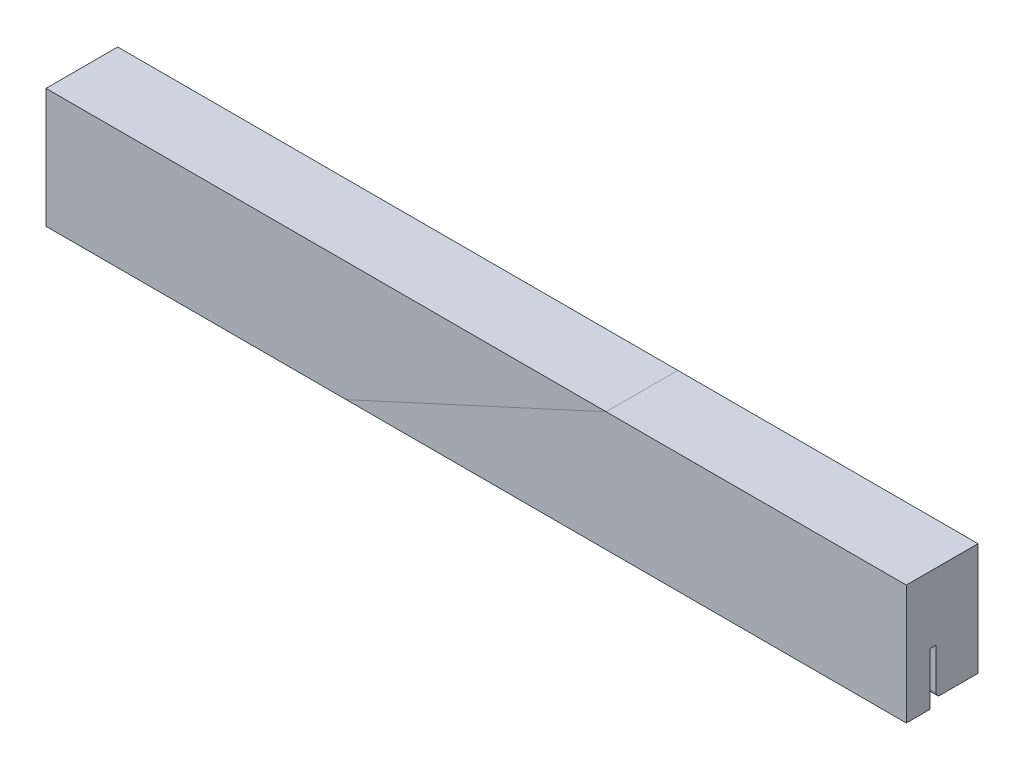
from build123d import *

# Parameters (mm, degrees)
SKETCH1_W              = 228.6
SKETCH1_H              = 25.4
SKETCH1_H_2            = 6.35
BOSS_EXTRUDE1_DEPTH    = 6.35
SKETCH1_3_W            = 228.6
SKETCH1_3_H            = 6.35
BOSS_EXTRUDE2_DEPTH    = 12.7
BOSS_EXTRUDE3_DEPTH    = 228.6
FILLET1_R              = 1.016
SPLIT2_SURFACE_1_BACK  = 232.579
SPLIT2_SURFACE_1_DEPTH = 465.158
SPLIT2_SURFACE_2_BACK  = 232.579
SPLIT2_SURFACE_2_DEPTH = 465.158


with BuildPart() as part:
    # Sketch1 → Boss-Extrude1 (new body)
    with BuildSketch(Plane.XY):
        Rectangle(SKETCH1_W, SKETCH1_H)
        with Locations((0, 15.875)):
            Rectangle(SKETCH1_W, SKETCH1_H_2)
    extrude(amount=BOSS_EXTRUDE1_DEPTH)

    # Sketch1<3> → Boss-Extrude2 (add)
    with BuildSketch(Plane.XY):
        with Locations((0, 15.875)):
            Rectangle(SKETCH1_3_W, SKETCH1_3_H)
    extrude(amount=-BOSS_EXTRUDE2_DEPTH)

    # Sketch4 → Boss-Extrude3 (add)
    with BuildSketch(Plane.ZY.offset(114.3)):
        Polygon((-12.7, 12.7), (-12.7, -10.795), (-1.6002, -10.795), (-1.6002, 1.27), (0, 1.27), (0, -12.7), (6.35, -12.7), (6.35, 19.05), (-12.7, 19.05), align=None)
    extrude(amount=-BOSS_EXTRUDE3_DEPTH)

    # Fillet1
    fillet1_edges = [part.edges().sort_by_distance(p)[0] for p in [
        (0, -10.795, -1.6002),
    ]]
    fillet(fillet1_edges, radius=FILLET1_R)


with BuildPart() as body_2:
    # Split2: the piece behind the surface
    add(part.part)
    # Split2 surface: a surface, the sketch's curves swept straight by 465.158 mm
    with BuildLine(Plane.XY.offset(6.35).offset(-SPLIT2_SURFACE_1_BACK), mode=Mode.PRIVATE) as split2_surface_1_path:
        Line((-34.542642552, -12.7), (34.542642552, 19.05))
    split2_surface_1 = Shell.extrude(split2_surface_1_path.wire(), (0 * SPLIT2_SURFACE_1_DEPTH, 0 * SPLIT2_SURFACE_1_DEPTH, 1 * SPLIT2_SURFACE_1_DEPTH))
    split(bisect_by=split2_surface_1, keep=Keep.BOTTOM)


with BuildPart() as part_1:
    add(part.part)

    # Split2: split by a surface, the side it looks to stays
    # Split2 surface: a surface, the sketch's curves swept straight by 465.158 mm
    with BuildLine(Plane.XY.offset(6.35).offset(-SPLIT2_SURFACE_2_BACK), mode=Mode.PRIVATE) as split2_surface_2_path:
        Line((-34.542642552, -12.7), (34.542642552, 19.05))
    split2_surface_2 = Shell.extrude(split2_surface_2_path.wire(), (0 * SPLIT2_SURFACE_2_DEPTH, 0 * SPLIT2_SURFACE_2_DEPTH, 1 * SPLIT2_SURFACE_2_DEPTH))
    split(bisect_by=split2_surface_2, keep=Keep.TOP)


solid = Compound([body_2.part, part_1.part])
